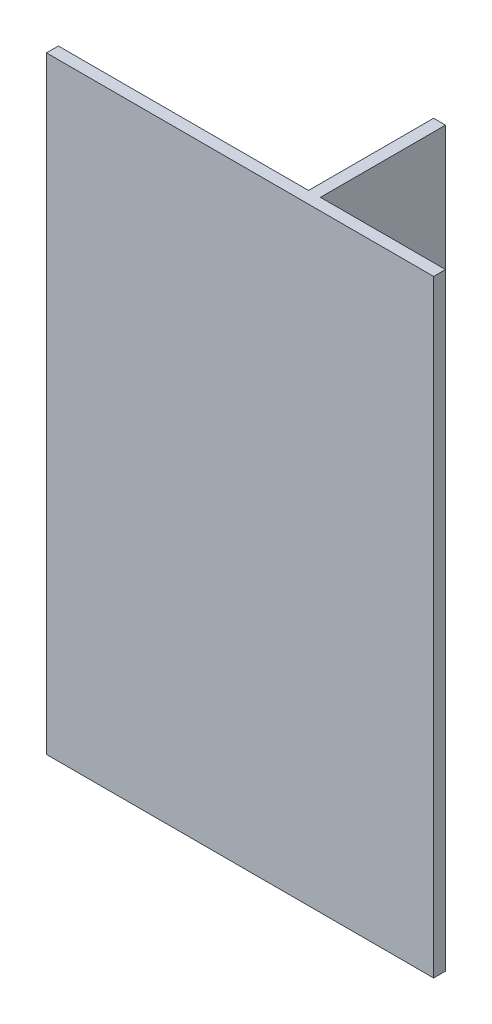
from build123d import *

# Parameters (mm, degrees)
BOSS_EXTRUDE1_DEPTH = 102


with BuildPart() as part:
    # Sketch1 → Boss-Extrude1 (new body)
    with BuildSketch(Plane(origin=(0, 0, 0), x_dir=(1, 0, 0), z_dir=(0, 1, 0))):
        Polygon((44, 2), (65, 2), (65, 0), (0, 0), (0, 2), (42, 2), (42, 23), (44, 23), align=None)
    extrude(amount=BOSS_EXTRUDE1_DEPTH)


solid = part.part
